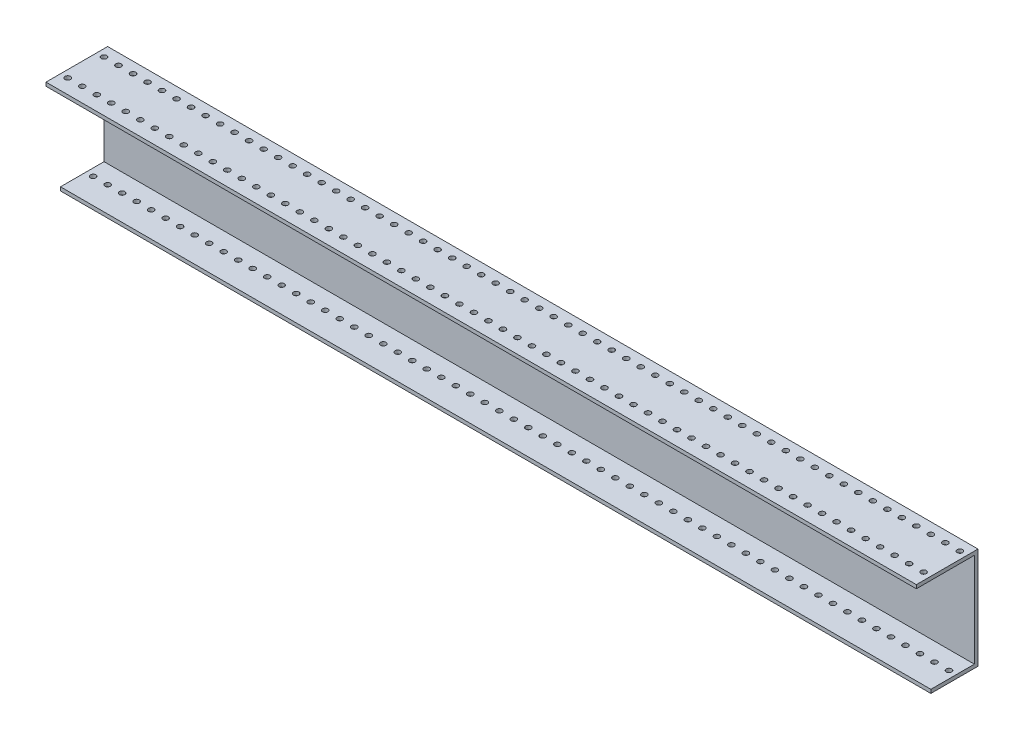
from build123d import *

# Parameters (mm, degrees)
SKETCH1_W                  = 762
SKETCH1_H                  = 88.9
BOSS_EXTRUDE1_DEPTH        = 3.175
SKETCH2_W                  = 762
SKETCH2_H                  = 3.175
BOSS_EXTRUDE2_DEPTH        = 50.8
SKETCH3_W                  = 762
SKETCH3_H                  = 3.175
BOSS_EXTRUDE3_DEPTH        = 38.1
SKETCH4_R                  = 2.38125
CUT_EXTRUDE1_DEPTH         = 3.175
LPATTERN1_COUNT            = 60
LPATTERN1_PITCH            = 12.7
LPATTERN1_COPY_1_SKETCH_R  = 2.38125
LPATTERN1_COPY_1_DEPTH     = 3.175
LPATTERN1_COPY_2_SKETCH_R  = 2.38125
LPATTERN1_COPY_2_DEPTH     = 3.175
LPATTERN1_COPY_3_SKETCH_R  = 2.38125
LPATTERN1_COPY_3_DEPTH     = 3.175
LPATTERN1_COPY_4_SKETCH_R  = 2.38125
LPATTERN1_COPY_4_DEPTH     = 3.175
LPATTERN1_COPY_5_SKETCH_R  = 2.38125
LPATTERN1_COPY_5_DEPTH     = 3.175
LPATTERN1_COPY_6_SKETCH_R  = 2.38125
LPATTERN1_COPY_6_DEPTH     = 3.175
LPATTERN1_COPY_7_SKETCH_R  = 2.38125
LPATTERN1_COPY_7_DEPTH     = 3.175
LPATTERN1_COPY_8_SKETCH_R  = 2.38125
LPATTERN1_COPY_8_DEPTH     = 3.175
LPATTERN1_COPY_9_SKETCH_R  = 2.38125
LPATTERN1_COPY_9_DEPTH     = 3.175
LPATTERN1_COPY_10_SKETCH_R = 2.38125
LPATTERN1_COPY_10_DEPTH    = 3.175
LPATTERN1_COPY_11_SKETCH_R = 2.38125
LPATTERN1_COPY_11_DEPTH    = 3.175
LPATTERN1_COPY_12_SKETCH_R = 2.38125
LPATTERN1_COPY_12_DEPTH    = 3.175
LPATTERN1_COPY_13_SKETCH_R = 2.38125
LPATTERN1_COPY_13_DEPTH    = 3.175
LPATTERN1_COPY_14_SKETCH_R = 2.38125
LPATTERN1_COPY_14_DEPTH    = 3.175
LPATTERN1_COPY_15_SKETCH_R = 2.38125
LPATTERN1_COPY_15_DEPTH    = 3.175
LPATTERN1_COPY_16_SKETCH_R = 2.38125
LPATTERN1_COPY_16_DEPTH    = 3.175
LPATTERN1_COPY_17_SKETCH_R = 2.38125
LPATTERN1_COPY_17_DEPTH    = 3.175
LPATTERN1_COPY_18_SKETCH_R = 2.38125
LPATTERN1_COPY_18_DEPTH    = 3.175
LPATTERN1_COPY_19_SKETCH_R = 2.38125
LPATTERN1_COPY_19_DEPTH    = 3.175
LPATTERN1_COPY_20_SKETCH_R = 2.38125
LPATTERN1_COPY_20_DEPTH    = 3.175
LPATTERN1_COPY_21_SKETCH_R = 2.38125
LPATTERN1_COPY_21_DEPTH    = 3.175
LPATTERN1_COPY_22_SKETCH_R = 2.38125
LPATTERN1_COPY_22_DEPTH    = 3.175
LPATTERN1_COPY_23_SKETCH_R = 2.38125
LPATTERN1_COPY_23_DEPTH    = 3.175
LPATTERN1_COPY_24_SKETCH_R = 2.38125
LPATTERN1_COPY_24_DEPTH    = 3.175
LPATTERN1_COPY_25_SKETCH_R = 2.38125
LPATTERN1_COPY_25_DEPTH    = 3.175
LPATTERN1_COPY_26_SKETCH_R = 2.38125
LPATTERN1_COPY_26_DEPTH    = 3.175
LPATTERN1_COPY_27_SKETCH_R = 2.38125
LPATTERN1_COPY_27_DEPTH    = 3.175
LPATTERN1_COPY_28_SKETCH_R = 2.38125
LPATTERN1_COPY_28_DEPTH    = 3.175
LPATTERN1_COPY_29_SKETCH_R = 2.38125
LPATTERN1_COPY_29_DEPTH    = 3.175
LPATTERN1_COPY_30_SKETCH_R = 2.38125
LPATTERN1_COPY_30_DEPTH    = 3.175
LPATTERN1_COPY_31_SKETCH_R = 2.38125
LPATTERN1_COPY_31_DEPTH    = 3.175
LPATTERN1_COPY_32_SKETCH_R = 2.38125
LPATTERN1_COPY_32_DEPTH    = 3.175
LPATTERN1_COPY_33_SKETCH_R = 2.38125
LPATTERN1_COPY_33_DEPTH    = 3.175
LPATTERN1_COPY_34_SKETCH_R = 2.38125
LPATTERN1_COPY_34_DEPTH    = 3.175
LPATTERN1_COPY_35_SKETCH_R = 2.38125
LPATTERN1_COPY_35_DEPTH    = 3.175
LPATTERN1_COPY_36_SKETCH_R = 2.38125
LPATTERN1_COPY_36_DEPTH    = 3.175
LPATTERN1_COPY_37_SKETCH_R = 2.38125
LPATTERN1_COPY_37_DEPTH    = 3.175
LPATTERN1_COPY_38_SKETCH_R = 2.38125
LPATTERN1_COPY_38_DEPTH    = 3.175
LPATTERN1_COPY_39_SKETCH_R = 2.38125
LPATTERN1_COPY_39_DEPTH    = 3.175
LPATTERN1_COPY_40_SKETCH_R = 2.38125
LPATTERN1_COPY_40_DEPTH    = 3.175
LPATTERN1_COPY_41_SKETCH_R = 2.38125
LPATTERN1_COPY_41_DEPTH    = 3.175
LPATTERN1_COPY_42_SKETCH_R = 2.38125
LPATTERN1_COPY_42_DEPTH    = 3.175
LPATTERN1_COPY_43_SKETCH_R = 2.38125
LPATTERN1_COPY_43_DEPTH    = 3.175
LPATTERN1_COPY_44_SKETCH_R = 2.38125
LPATTERN1_COPY_44_DEPTH    = 3.175
LPATTERN1_COPY_45_SKETCH_R = 2.38125
LPATTERN1_COPY_45_DEPTH    = 3.175
LPATTERN1_COPY_46_SKETCH_R = 2.38125
LPATTERN1_COPY_46_DEPTH    = 3.175
LPATTERN1_COPY_47_SKETCH_R = 2.38125
LPATTERN1_COPY_47_DEPTH    = 3.175
LPATTERN1_COPY_48_SKETCH_R = 2.38125
LPATTERN1_COPY_48_DEPTH    = 3.175
LPATTERN1_COPY_49_SKETCH_R = 2.38125
LPATTERN1_COPY_49_DEPTH    = 3.175
LPATTERN1_COPY_50_SKETCH_R = 2.38125
LPATTERN1_COPY_50_DEPTH    = 3.175
LPATTERN1_COPY_51_SKETCH_R = 2.38125
LPATTERN1_COPY_51_DEPTH    = 3.175
LPATTERN1_COPY_52_SKETCH_R = 2.38125
LPATTERN1_COPY_52_DEPTH    = 3.175
LPATTERN1_COPY_53_SKETCH_R = 2.38125
LPATTERN1_COPY_53_DEPTH    = 3.175
LPATTERN1_COPY_54_SKETCH_R = 2.38125
LPATTERN1_COPY_54_DEPTH    = 3.175
LPATTERN1_COPY_55_SKETCH_R = 2.38125
LPATTERN1_COPY_55_DEPTH    = 3.175
LPATTERN1_COPY_56_SKETCH_R = 2.38125
LPATTERN1_COPY_56_DEPTH    = 3.175
LPATTERN1_COPY_57_SKETCH_R = 2.38125
LPATTERN1_COPY_57_DEPTH    = 3.175
LPATTERN1_COPY_58_SKETCH_R = 2.38125
LPATTERN1_COPY_58_DEPTH    = 3.175
LPATTERN1_COPY_59_SKETCH_R = 2.38125
LPATTERN1_COPY_59_DEPTH    = 3.175
SKETCH5_R                  = 2.38125
CUT_EXTRUDE2_DEPTH         = 3.175
LPATTERN3_COUNT            = 60
LPATTERN3_PITCH            = 12.7


with BuildPart() as part:
    # Sketch1 → Boss-Extrude1 (new body)
    with BuildSketch(Plane.XY):
        with Locations((381, 44.45)):
            Rectangle(SKETCH1_W, SKETCH1_H)
    extrude(amount=BOSS_EXTRUDE1_DEPTH)

    # Sketch2 → Boss-Extrude2 (add)
    with BuildSketch(Plane.XY.offset(3.175)):
        with Locations((381, 87.3125)):
            Rectangle(SKETCH2_W, SKETCH2_H)
    extrude(amount=BOSS_EXTRUDE2_DEPTH)

    # Sketch3 → Boss-Extrude3 (add)
    with BuildSketch(Plane.XY.offset(3.175)):
        with Locations((381, 1.5875)):
            Rectangle(SKETCH3_W, SKETCH3_H)
    extrude(amount=BOSS_EXTRUDE3_DEPTH)

    # Sketch4 → Cut-Extrude1 (cut)
    with BuildSketch(Plane(origin=(0, 88.9, 0), x_dir=(1, 0, 0), z_dir=(0, 1, 0))):
        with Locations(Location((755.65, -41.275, 0), (0, 0, 270))):
            Circle(SKETCH4_R)
    cut_extrude1 = extrude(amount=-CUT_EXTRUDE1_DEPTH, mode=Mode.SUBTRACT)

    # Mirror1: Cut-Extrude1 across plane
    add(cut_extrude1.mirror(Plane(origin=(0, 0, 25.4), x_dir=(1, 0, 0), z_dir=(0, 0, -1))), mode=Mode.SUBTRACT)

    # LPattern1: Cut-Extrude1 ×60
    with Locations(*[(-i * LPATTERN1_PITCH, 0, 0) for i in range(1, LPATTERN1_COUNT)]):
        add(cut_extrude1, mode=Mode.SUBTRACT)

    # LPattern1 copy 1 sketch → LPattern1 copy 1 (cut)
    with BuildSketch(Plane(origin=(-12.7, 88.9, 50.8), x_dir=(1, 0, 0), z_dir=(0, 1, 0))):
        with Locations((755.65, 41.275)):
            Circle(LPATTERN1_COPY_1_SKETCH_R)
    extrude(amount=-LPATTERN1_COPY_1_DEPTH, mode=Mode.SUBTRACT)

    # LPattern1 copy 2 sketch → LPattern1 copy 2 (cut)
    with BuildSketch(Plane(origin=(-25.4, 88.9, 50.8), x_dir=(1, 0, 0), z_dir=(0, 1, 0))):
        with Locations((755.65, 41.275)):
            Circle(LPATTERN1_COPY_2_SKETCH_R)
    extrude(amount=-LPATTERN1_COPY_2_DEPTH, mode=Mode.SUBTRACT)

    # LPattern1 copy 3 sketch → LPattern1 copy 3 (cut)
    with BuildSketch(Plane(origin=(-38.1, 88.9, 50.8), x_dir=(1, 0, 0), z_dir=(0, 1, 0))):
        with Locations((755.65, 41.275)):
            Circle(LPATTERN1_COPY_3_SKETCH_R)
    extrude(amount=-LPATTERN1_COPY_3_DEPTH, mode=Mode.SUBTRACT)

    # LPattern1 copy 4 sketch → LPattern1 copy 4 (cut)
    with BuildSketch(Plane(origin=(-50.8, 88.9, 50.8), x_dir=(1, 0, 0), z_dir=(0, 1, 0))):
        with Locations((755.65, 41.275)):
            Circle(LPATTERN1_COPY_4_SKETCH_R)
    extrude(amount=-LPATTERN1_COPY_4_DEPTH, mode=Mode.SUBTRACT)

    # LPattern1 copy 5 sketch → LPattern1 copy 5 (cut)
    with BuildSketch(Plane(origin=(-63.5, 88.9, 50.8), x_dir=(1, 0, 0), z_dir=(0, 1, 0))):
        with Locations((755.65, 41.275)):
            Circle(LPATTERN1_COPY_5_SKETCH_R)
    extrude(amount=-LPATTERN1_COPY_5_DEPTH, mode=Mode.SUBTRACT)

    # LPattern1 copy 6 sketch → LPattern1 copy 6 (cut)
    with BuildSketch(Plane(origin=(-76.2, 88.9, 50.8), x_dir=(1, 0, 0), z_dir=(0, 1, 0))):
        with Locations((755.65, 41.275)):
            Circle(LPATTERN1_COPY_6_SKETCH_R)
    extrude(amount=-LPATTERN1_COPY_6_DEPTH, mode=Mode.SUBTRACT)

    # LPattern1 copy 7 sketch → LPattern1 copy 7 (cut)
    with BuildSketch(Plane(origin=(-88.9, 88.9, 50.8), x_dir=(1, 0, 0), z_dir=(0, 1, 0))):
        with Locations((755.65, 41.275)):
            Circle(LPATTERN1_COPY_7_SKETCH_R)
    extrude(amount=-LPATTERN1_COPY_7_DEPTH, mode=Mode.SUBTRACT)

    # LPattern1 copy 8 sketch → LPattern1 copy 8 (cut)
    with BuildSketch(Plane(origin=(-101.6, 88.9, 50.8), x_dir=(1, 0, 0), z_dir=(0, 1, 0))):
        with Locations((755.65, 41.275)):
            Circle(LPATTERN1_COPY_8_SKETCH_R)
    extrude(amount=-LPATTERN1_COPY_8_DEPTH, mode=Mode.SUBTRACT)

    # LPattern1 copy 9 sketch → LPattern1 copy 9 (cut)
    with BuildSketch(Plane(origin=(-114.3, 88.9, 50.8), x_dir=(1, 0, 0), z_dir=(0, 1, 0))):
        with Locations((755.65, 41.275)):
            Circle(LPATTERN1_COPY_9_SKETCH_R)
    extrude(amount=-LPATTERN1_COPY_9_DEPTH, mode=Mode.SUBTRACT)

    # LPattern1 copy 10 sketch → LPattern1 copy 10 (cut)
    with BuildSketch(Plane(origin=(-127, 88.9, 50.8), x_dir=(1, 0, 0), z_dir=(0, 1, 0))):
        with Locations((755.65, 41.275)):
            Circle(LPATTERN1_COPY_10_SKETCH_R)
    extrude(amount=-LPATTERN1_COPY_10_DEPTH, mode=Mode.SUBTRACT)

    # LPattern1 copy 11 sketch → LPattern1 copy 11 (cut)
    with BuildSketch(Plane(origin=(-139.7, 88.9, 50.8), x_dir=(1, 0, 0), z_dir=(0, 1, 0))):
        with Locations((755.65, 41.275)):
            Circle(LPATTERN1_COPY_11_SKETCH_R)
    extrude(amount=-LPATTERN1_COPY_11_DEPTH, mode=Mode.SUBTRACT)

    # LPattern1 copy 12 sketch → LPattern1 copy 12 (cut)
    with BuildSketch(Plane(origin=(-152.4, 88.9, 50.8), x_dir=(1, 0, 0), z_dir=(0, 1, 0))):
        with Locations((755.65, 41.275)):
            Circle(LPATTERN1_COPY_12_SKETCH_R)
    extrude(amount=-LPATTERN1_COPY_12_DEPTH, mode=Mode.SUBTRACT)

    # LPattern1 copy 13 sketch → LPattern1 copy 13 (cut)
    with BuildSketch(Plane(origin=(-165.1, 88.9, 50.8), x_dir=(1, 0, 0), z_dir=(0, 1, 0))):
        with Locations((755.65, 41.275)):
            Circle(LPATTERN1_COPY_13_SKETCH_R)
    extrude(amount=-LPATTERN1_COPY_13_DEPTH, mode=Mode.SUBTRACT)

    # LPattern1 copy 14 sketch → LPattern1 copy 14 (cut)
    with BuildSketch(Plane(origin=(-177.8, 88.9, 50.8), x_dir=(1, 0, 0), z_dir=(0, 1, 0))):
        with Locations((755.65, 41.275)):
            Circle(LPATTERN1_COPY_14_SKETCH_R)
    extrude(amount=-LPATTERN1_COPY_14_DEPTH, mode=Mode.SUBTRACT)

    # LPattern1 copy 15 sketch → LPattern1 copy 15 (cut)
    with BuildSketch(Plane(origin=(-190.5, 88.9, 50.8), x_dir=(1, 0, 0), z_dir=(0, 1, 0))):
        with Locations((755.65, 41.275)):
            Circle(LPATTERN1_COPY_15_SKETCH_R)
    extrude(amount=-LPATTERN1_COPY_15_DEPTH, mode=Mode.SUBTRACT)

    # LPattern1 copy 16 sketch → LPattern1 copy 16 (cut)
    with BuildSketch(Plane(origin=(-203.2, 88.9, 50.8), x_dir=(1, 0, 0), z_dir=(0, 1, 0))):
        with Locations((755.65, 41.275)):
            Circle(LPATTERN1_COPY_16_SKETCH_R)
    extrude(amount=-LPATTERN1_COPY_16_DEPTH, mode=Mode.SUBTRACT)

    # LPattern1 copy 17 sketch → LPattern1 copy 17 (cut)
    with BuildSketch(Plane(origin=(-215.9, 88.9, 50.8), x_dir=(1, 0, 0), z_dir=(0, 1, 0))):
        with Locations((755.65, 41.275)):
            Circle(LPATTERN1_COPY_17_SKETCH_R)
    extrude(amount=-LPATTERN1_COPY_17_DEPTH, mode=Mode.SUBTRACT)

    # LPattern1 copy 18 sketch → LPattern1 copy 18 (cut)
    with BuildSketch(Plane(origin=(-228.6, 88.9, 50.8), x_dir=(1, 0, 0), z_dir=(0, 1, 0))):
        with Locations((755.65, 41.275)):
            Circle(LPATTERN1_COPY_18_SKETCH_R)
    extrude(amount=-LPATTERN1_COPY_18_DEPTH, mode=Mode.SUBTRACT)

    # LPattern1 copy 19 sketch → LPattern1 copy 19 (cut)
    with BuildSketch(Plane(origin=(-241.3, 88.9, 50.8), x_dir=(1, 0, 0), z_dir=(0, 1, 0))):
        with Locations((755.65, 41.275)):
            Circle(LPATTERN1_COPY_19_SKETCH_R)
    extrude(amount=-LPATTERN1_COPY_19_DEPTH, mode=Mode.SUBTRACT)

    # LPattern1 copy 20 sketch → LPattern1 copy 20 (cut)
    with BuildSketch(Plane(origin=(-254, 88.9, 50.8), x_dir=(1, 0, 0), z_dir=(0, 1, 0))):
        with Locations((755.65, 41.275)):
            Circle(LPATTERN1_COPY_20_SKETCH_R)
    extrude(amount=-LPATTERN1_COPY_20_DEPTH, mode=Mode.SUBTRACT)

    # LPattern1 copy 21 sketch → LPattern1 copy 21 (cut)
    with BuildSketch(Plane(origin=(-266.7, 88.9, 50.8), x_dir=(1, 0, 0), z_dir=(0, 1, 0))):
        with Locations((755.65, 41.275)):
            Circle(LPATTERN1_COPY_21_SKETCH_R)
    extrude(amount=-LPATTERN1_COPY_21_DEPTH, mode=Mode.SUBTRACT)

    # LPattern1 copy 22 sketch → LPattern1 copy 22 (cut)
    with BuildSketch(Plane(origin=(-279.4, 88.9, 50.8), x_dir=(1, 0, 0), z_dir=(0, 1, 0))):
        with Locations((755.65, 41.275)):
            Circle(LPATTERN1_COPY_22_SKETCH_R)
    extrude(amount=-LPATTERN1_COPY_22_DEPTH, mode=Mode.SUBTRACT)

    # LPattern1 copy 23 sketch → LPattern1 copy 23 (cut)
    with BuildSketch(Plane(origin=(-292.1, 88.9, 50.8), x_dir=(1, 0, 0), z_dir=(0, 1, 0))):
        with Locations((755.65, 41.275)):
            Circle(LPATTERN1_COPY_23_SKETCH_R)
    extrude(amount=-LPATTERN1_COPY_23_DEPTH, mode=Mode.SUBTRACT)

    # LPattern1 copy 24 sketch → LPattern1 copy 24 (cut)
    with BuildSketch(Plane(origin=(-304.8, 88.9, 50.8), x_dir=(1, 0, 0), z_dir=(0, 1, 0))):
        with Locations((755.65, 41.275)):
            Circle(LPATTERN1_COPY_24_SKETCH_R)
    extrude(amount=-LPATTERN1_COPY_24_DEPTH, mode=Mode.SUBTRACT)

    # LPattern1 copy 25 sketch → LPattern1 copy 25 (cut)
    with BuildSketch(Plane(origin=(-317.5, 88.9, 50.8), x_dir=(1, 0, 0), z_dir=(0, 1, 0))):
        with Locations((755.65, 41.275)):
            Circle(LPATTERN1_COPY_25_SKETCH_R)
    extrude(amount=-LPATTERN1_COPY_25_DEPTH, mode=Mode.SUBTRACT)

    # LPattern1 copy 26 sketch → LPattern1 copy 26 (cut)
    with BuildSketch(Plane(origin=(-330.2, 88.9, 50.8), x_dir=(1, 0, 0), z_dir=(0, 1, 0))):
        with Locations((755.65, 41.275)):
            Circle(LPATTERN1_COPY_26_SKETCH_R)
    extrude(amount=-LPATTERN1_COPY_26_DEPTH, mode=Mode.SUBTRACT)

    # LPattern1 copy 27 sketch → LPattern1 copy 27 (cut)
    with BuildSketch(Plane(origin=(-342.9, 88.9, 50.8), x_dir=(1, 0, 0), z_dir=(0, 1, 0))):
        with Locations((755.65, 41.275)):
            Circle(LPATTERN1_COPY_27_SKETCH_R)
    extrude(amount=-LPATTERN1_COPY_27_DEPTH, mode=Mode.SUBTRACT)

    # LPattern1 copy 28 sketch → LPattern1 copy 28 (cut)
    with BuildSketch(Plane(origin=(-355.6, 88.9, 50.8), x_dir=(1, 0, 0), z_dir=(0, 1, 0))):
        with Locations((755.65, 41.275)):
            Circle(LPATTERN1_COPY_28_SKETCH_R)
    extrude(amount=-LPATTERN1_COPY_28_DEPTH, mode=Mode.SUBTRACT)

    # LPattern1 copy 29 sketch → LPattern1 copy 29 (cut)
    with BuildSketch(Plane(origin=(-368.3, 88.9, 50.8), x_dir=(1, 0, 0), z_dir=(0, 1, 0))):
        with Locations((755.65, 41.275)):
            Circle(LPATTERN1_COPY_29_SKETCH_R)
    extrude(amount=-LPATTERN1_COPY_29_DEPTH, mode=Mode.SUBTRACT)

    # LPattern1 copy 30 sketch → LPattern1 copy 30 (cut)
    with BuildSketch(Plane(origin=(-381, 88.9, 50.8), x_dir=(1, 0, 0), z_dir=(0, 1, 0))):
        with Locations((755.65, 41.275)):
            Circle(LPATTERN1_COPY_30_SKETCH_R)
    extrude(amount=-LPATTERN1_COPY_30_DEPTH, mode=Mode.SUBTRACT)

    # LPattern1 copy 31 sketch → LPattern1 copy 31 (cut)
    with BuildSketch(Plane(origin=(-393.7, 88.9, 50.8), x_dir=(1, 0, 0), z_dir=(0, 1, 0))):
        with Locations((755.65, 41.275)):
            Circle(LPATTERN1_COPY_31_SKETCH_R)
    extrude(amount=-LPATTERN1_COPY_31_DEPTH, mode=Mode.SUBTRACT)

    # LPattern1 copy 32 sketch → LPattern1 copy 32 (cut)
    with BuildSketch(Plane(origin=(-406.4, 88.9, 50.8), x_dir=(1, 0, 0), z_dir=(0, 1, 0))):
        with Locations((755.65, 41.275)):
            Circle(LPATTERN1_COPY_32_SKETCH_R)
    extrude(amount=-LPATTERN1_COPY_32_DEPTH, mode=Mode.SUBTRACT)

    # LPattern1 copy 33 sketch → LPattern1 copy 33 (cut)
    with BuildSketch(Plane(origin=(-419.1, 88.9, 50.8), x_dir=(1, 0, 0), z_dir=(0, 1, 0))):
        with Locations((755.65, 41.275)):
            Circle(LPATTERN1_COPY_33_SKETCH_R)
    extrude(amount=-LPATTERN1_COPY_33_DEPTH, mode=Mode.SUBTRACT)

    # LPattern1 copy 34 sketch → LPattern1 copy 34 (cut)
    with BuildSketch(Plane(origin=(-431.8, 88.9, 50.8), x_dir=(1, 0, 0), z_dir=(0, 1, 0))):
        with Locations((755.65, 41.275)):
            Circle(LPATTERN1_COPY_34_SKETCH_R)
    extrude(amount=-LPATTERN1_COPY_34_DEPTH, mode=Mode.SUBTRACT)

    # LPattern1 copy 35 sketch → LPattern1 copy 35 (cut)
    with BuildSketch(Plane(origin=(-444.5, 88.9, 50.8), x_dir=(1, 0, 0), z_dir=(0, 1, 0))):
        with Locations((755.65, 41.275)):
            Circle(LPATTERN1_COPY_35_SKETCH_R)
    extrude(amount=-LPATTERN1_COPY_35_DEPTH, mode=Mode.SUBTRACT)

    # LPattern1 copy 36 sketch → LPattern1 copy 36 (cut)
    with BuildSketch(Plane(origin=(-457.2, 88.9, 50.8), x_dir=(1, 0, 0), z_dir=(0, 1, 0))):
        with Locations((755.65, 41.275)):
            Circle(LPATTERN1_COPY_36_SKETCH_R)
    extrude(amount=-LPATTERN1_COPY_36_DEPTH, mode=Mode.SUBTRACT)

    # LPattern1 copy 37 sketch → LPattern1 copy 37 (cut)
    with BuildSketch(Plane(origin=(-469.9, 88.9, 50.8), x_dir=(1, 0, 0), z_dir=(0, 1, 0))):
        with Locations((755.65, 41.275)):
            Circle(LPATTERN1_COPY_37_SKETCH_R)
    extrude(amount=-LPATTERN1_COPY_37_DEPTH, mode=Mode.SUBTRACT)

    # LPattern1 copy 38 sketch → LPattern1 copy 38 (cut)
    with BuildSketch(Plane(origin=(-482.6, 88.9, 50.8), x_dir=(1, 0, 0), z_dir=(0, 1, 0))):
        with Locations((755.65, 41.275)):
            Circle(LPATTERN1_COPY_38_SKETCH_R)
    extrude(amount=-LPATTERN1_COPY_38_DEPTH, mode=Mode.SUBTRACT)

    # LPattern1 copy 39 sketch → LPattern1 copy 39 (cut)
    with BuildSketch(Plane(origin=(-495.3, 88.9, 50.8), x_dir=(1, 0, 0), z_dir=(0, 1, 0))):
        with Locations((755.65, 41.275)):
            Circle(LPATTERN1_COPY_39_SKETCH_R)
    extrude(amount=-LPATTERN1_COPY_39_DEPTH, mode=Mode.SUBTRACT)

    # LPattern1 copy 40 sketch → LPattern1 copy 40 (cut)
    with BuildSketch(Plane(origin=(-508, 88.9, 50.8), x_dir=(1, 0, 0), z_dir=(0, 1, 0))):
        with Locations((755.65, 41.275)):
            Circle(LPATTERN1_COPY_40_SKETCH_R)
    extrude(amount=-LPATTERN1_COPY_40_DEPTH, mode=Mode.SUBTRACT)

    # LPattern1 copy 41 sketch → LPattern1 copy 41 (cut)
    with BuildSketch(Plane(origin=(-520.7, 88.9, 50.8), x_dir=(1, 0, 0), z_dir=(0, 1, 0))):
        with Locations((755.65, 41.275)):
            Circle(LPATTERN1_COPY_41_SKETCH_R)
    extrude(amount=-LPATTERN1_COPY_41_DEPTH, mode=Mode.SUBTRACT)

    # LPattern1 copy 42 sketch → LPattern1 copy 42 (cut)
    with BuildSketch(Plane(origin=(-533.4, 88.9, 50.8), x_dir=(1, 0, 0), z_dir=(0, 1, 0))):
        with Locations((755.65, 41.275)):
            Circle(LPATTERN1_COPY_42_SKETCH_R)
    extrude(amount=-LPATTERN1_COPY_42_DEPTH, mode=Mode.SUBTRACT)

    # LPattern1 copy 43 sketch → LPattern1 copy 43 (cut)
    with BuildSketch(Plane(origin=(-546.1, 88.9, 50.8), x_dir=(1, 0, 0), z_dir=(0, 1, 0))):
        with Locations((755.65, 41.275)):
            Circle(LPATTERN1_COPY_43_SKETCH_R)
    extrude(amount=-LPATTERN1_COPY_43_DEPTH, mode=Mode.SUBTRACT)

    # LPattern1 copy 44 sketch → LPattern1 copy 44 (cut)
    with BuildSketch(Plane(origin=(-558.8, 88.9, 50.8), x_dir=(1, 0, 0), z_dir=(0, 1, 0))):
        with Locations((755.65, 41.275)):
            Circle(LPATTERN1_COPY_44_SKETCH_R)
    extrude(amount=-LPATTERN1_COPY_44_DEPTH, mode=Mode.SUBTRACT)

    # LPattern1 copy 45 sketch → LPattern1 copy 45 (cut)
    with BuildSketch(Plane(origin=(-571.5, 88.9, 50.8), x_dir=(1, 0, 0), z_dir=(0, 1, 0))):
        with Locations((755.65, 41.275)):
            Circle(LPATTERN1_COPY_45_SKETCH_R)
    extrude(amount=-LPATTERN1_COPY_45_DEPTH, mode=Mode.SUBTRACT)

    # LPattern1 copy 46 sketch → LPattern1 copy 46 (cut)
    with BuildSketch(Plane(origin=(-584.2, 88.9, 50.8), x_dir=(1, 0, 0), z_dir=(0, 1, 0))):
        with Locations((755.65, 41.275)):
            Circle(LPATTERN1_COPY_46_SKETCH_R)
    extrude(amount=-LPATTERN1_COPY_46_DEPTH, mode=Mode.SUBTRACT)

    # LPattern1 copy 47 sketch → LPattern1 copy 47 (cut)
    with BuildSketch(Plane(origin=(-596.9, 88.9, 50.8), x_dir=(1, 0, 0), z_dir=(0, 1, 0))):
        with Locations((755.65, 41.275)):
            Circle(LPATTERN1_COPY_47_SKETCH_R)
    extrude(amount=-LPATTERN1_COPY_47_DEPTH, mode=Mode.SUBTRACT)

    # LPattern1 copy 48 sketch → LPattern1 copy 48 (cut)
    with BuildSketch(Plane(origin=(-609.6, 88.9, 50.8), x_dir=(1, 0, 0), z_dir=(0, 1, 0))):
        with Locations((755.65, 41.275)):
            Circle(LPATTERN1_COPY_48_SKETCH_R)
    extrude(amount=-LPATTERN1_COPY_48_DEPTH, mode=Mode.SUBTRACT)

    # LPattern1 copy 49 sketch → LPattern1 copy 49 (cut)
    with BuildSketch(Plane(origin=(-622.3, 88.9, 50.8), x_dir=(1, 0, 0), z_dir=(0, 1, 0))):
        with Locations((755.65, 41.275)):
            Circle(LPATTERN1_COPY_49_SKETCH_R)
    extrude(amount=-LPATTERN1_COPY_49_DEPTH, mode=Mode.SUBTRACT)

    # LPattern1 copy 50 sketch → LPattern1 copy 50 (cut)
    with BuildSketch(Plane(origin=(-635, 88.9, 50.8), x_dir=(1, 0, 0), z_dir=(0, 1, 0))):
        with Locations((755.65, 41.275)):
            Circle(LPATTERN1_COPY_50_SKETCH_R)
    extrude(amount=-LPATTERN1_COPY_50_DEPTH, mode=Mode.SUBTRACT)

    # LPattern1 copy 51 sketch → LPattern1 copy 51 (cut)
    with BuildSketch(Plane(origin=(-647.7, 88.9, 50.8), x_dir=(1, 0, 0), z_dir=(0, 1, 0))):
        with Locations((755.65, 41.275)):
            Circle(LPATTERN1_COPY_51_SKETCH_R)
    extrude(amount=-LPATTERN1_COPY_51_DEPTH, mode=Mode.SUBTRACT)

    # LPattern1 copy 52 sketch → LPattern1 copy 52 (cut)
    with BuildSketch(Plane(origin=(-660.4, 88.9, 50.8), x_dir=(1, 0, 0), z_dir=(0, 1, 0))):
        with Locations((755.65, 41.275)):
            Circle(LPATTERN1_COPY_52_SKETCH_R)
    extrude(amount=-LPATTERN1_COPY_52_DEPTH, mode=Mode.SUBTRACT)

    # LPattern1 copy 53 sketch → LPattern1 copy 53 (cut)
    with BuildSketch(Plane(origin=(-673.1, 88.9, 50.8), x_dir=(1, 0, 0), z_dir=(0, 1, 0))):
        with Locations((755.65, 41.275)):
            Circle(LPATTERN1_COPY_53_SKETCH_R)
    extrude(amount=-LPATTERN1_COPY_53_DEPTH, mode=Mode.SUBTRACT)

    # LPattern1 copy 54 sketch → LPattern1 copy 54 (cut)
    with BuildSketch(Plane(origin=(-685.8, 88.9, 50.8), x_dir=(1, 0, 0), z_dir=(0, 1, 0))):
        with Locations((755.65, 41.275)):
            Circle(LPATTERN1_COPY_54_SKETCH_R)
    extrude(amount=-LPATTERN1_COPY_54_DEPTH, mode=Mode.SUBTRACT)

    # LPattern1 copy 55 sketch → LPattern1 copy 55 (cut)
    with BuildSketch(Plane(origin=(-698.5, 88.9, 50.8), x_dir=(1, 0, 0), z_dir=(0, 1, 0))):
        with Locations((755.65, 41.275)):
            Circle(LPATTERN1_COPY_55_SKETCH_R)
    extrude(amount=-LPATTERN1_COPY_55_DEPTH, mode=Mode.SUBTRACT)

    # LPattern1 copy 56 sketch → LPattern1 copy 56 (cut)
    with BuildSketch(Plane(origin=(-711.2, 88.9, 50.8), x_dir=(1, 0, 0), z_dir=(0, 1, 0))):
        with Locations((755.65, 41.275)):
            Circle(LPATTERN1_COPY_56_SKETCH_R)
    extrude(amount=-LPATTERN1_COPY_56_DEPTH, mode=Mode.SUBTRACT)

    # LPattern1 copy 57 sketch → LPattern1 copy 57 (cut)
    with BuildSketch(Plane(origin=(-723.9, 88.9, 50.8), x_dir=(1, 0, 0), z_dir=(0, 1, 0))):
        with Locations((755.65, 41.275)):
            Circle(LPATTERN1_COPY_57_SKETCH_R)
    extrude(amount=-LPATTERN1_COPY_57_DEPTH, mode=Mode.SUBTRACT)

    # LPattern1 copy 58 sketch → LPattern1 copy 58 (cut)
    with BuildSketch(Plane(origin=(-736.6, 88.9, 50.8), x_dir=(1, 0, 0), z_dir=(0, 1, 0))):
        with Locations((755.65, 41.275)):
            Circle(LPATTERN1_COPY_58_SKETCH_R)
    extrude(amount=-LPATTERN1_COPY_58_DEPTH, mode=Mode.SUBTRACT)

    # LPattern1 copy 59 sketch → LPattern1 copy 59 (cut)
    with BuildSketch(Plane(origin=(-749.3, 88.9, 50.8), x_dir=(1, 0, 0), z_dir=(0, 1, 0))):
        with Locations((755.65, 41.275)):
            Circle(LPATTERN1_COPY_59_SKETCH_R)
    extrude(amount=-LPATTERN1_COPY_59_DEPTH, mode=Mode.SUBTRACT)

    # Sketch5 → Cut-Extrude2 (cut)
    with BuildSketch(Plane(origin=(0, 0, 0), x_dir=(-1, 0, 0), z_dir=(0, -1, 0))):
        with Locations(Location((-6.35, -19.05, 0), (0, 0, 90))):
            Circle(SKETCH5_R)
    cut_extrude2 = extrude(amount=-CUT_EXTRUDE2_DEPTH, mode=Mode.SUBTRACT)

    # LPattern3: Cut-Extrude2 ×60
    with Locations(*[(i * LPATTERN3_PITCH, 0, 0) for i in range(1, LPATTERN3_COUNT)]):
        add(cut_extrude2, mode=Mode.SUBTRACT)


solid = part.part
